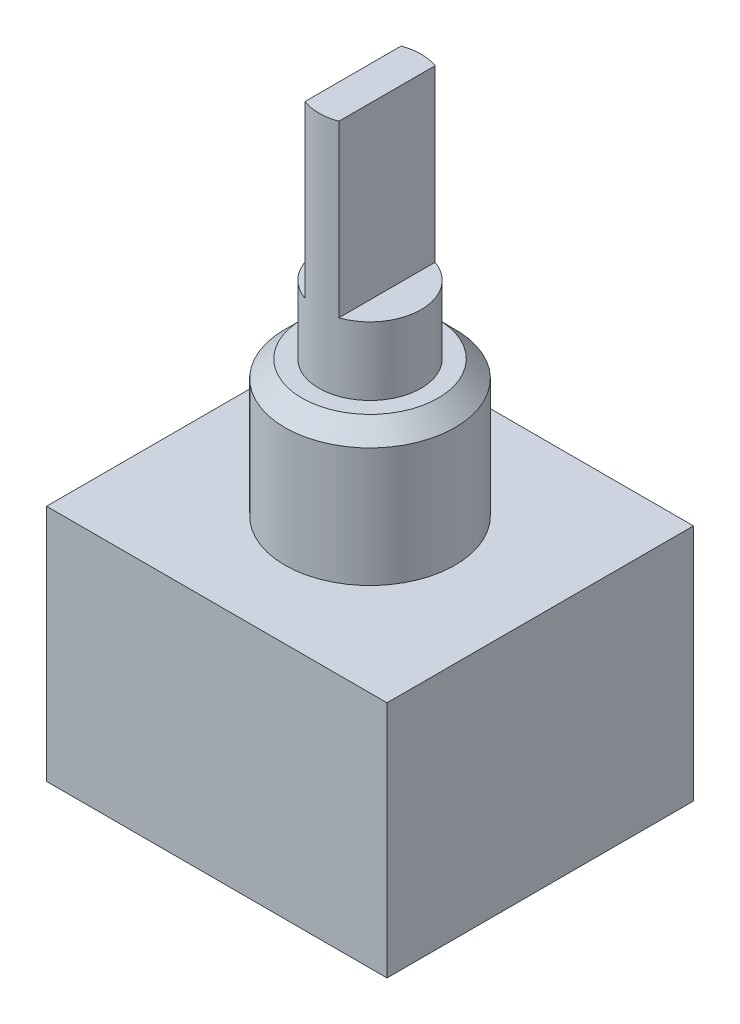
from build123d import *

# Parameters (mm, degrees)
SKETCH_1_W          = 10
SKETCH_1_H          = 9
EXTRUDE_1_DEPTH     = 7
SKETCH_2_R          = 2.5
EXTRUDE_2_DEPTH     = 4
CHAMFER_1_SIZE      = 0.5
SKETCH_3_R          = 1.5
EXTRUDE_3_DEPTH     = 7
CUT_EXTRUDE_START   = -5
CUT_EXTRUDE_1_DEPTH = 5


with BuildPart() as part:
    # 草图1 → 凸台-拉伸1 (new body)
    with BuildSketch(Plane(origin=(0, 0, 0), x_dir=(1, 0, 0), z_dir=(0, 1, 0))):
        Rectangle(SKETCH_1_W, SKETCH_1_H)
    extrude(amount=EXTRUDE_1_DEPTH)

    # 草图2 → 凸台-拉伸2 (add)
    with BuildSketch(Plane(origin=(0, 7, 0), x_dir=(1, 0, 0), z_dir=(0, 1, 0))):
        with Locations(Location((0, 0, 0), (0, 0, 270))):
            Circle(SKETCH_2_R)
    extrude(amount=EXTRUDE_2_DEPTH)

    # 倒角1
    chamfer_1_edges = [part.edges().sort_by_distance(p)[0] for p in [
        (0, 11, -2.5),
    ]]
    chamfer(chamfer_1_edges, length=CHAMFER_1_SIZE)

    # 草图3 → 凸台-拉伸3 (add)
    with BuildSketch(Plane(origin=(0, 11, 0), x_dir=(1, 0, 0), z_dir=(0, 1, 0))):
        with Locations(Location((0, 0, 0), (0, 0, 270))):
            Circle(SKETCH_3_R)
    extrude(amount=EXTRUDE_3_DEPTH)

    # 草图4 → 切除-拉伸1 (cut)
    with BuildSketch(Plane(origin=(0, 18, 0), x_dir=(1, 0, 0), z_dir=(0, 1, 0)).offset(CUT_EXTRUDE_START)):
        with BuildLine():
            Line((-0.5, 1.414213562), (-0.5, -1.414213562))
            ThreePointArc((-0.5, -1.414213562), (-1.5, 0), (-0.5, 1.414213562))
        make_face()
        with BuildLine():
            Line((0.5, 1.414213562), (0.5, -1.414213562))
            ThreePointArc((0.5, -1.414213562), (1.5, 0), (0.5, 1.414213562))
        make_face()
    extrude(amount=CUT_EXTRUDE_1_DEPTH, mode=Mode.SUBTRACT)


solid = part.part
